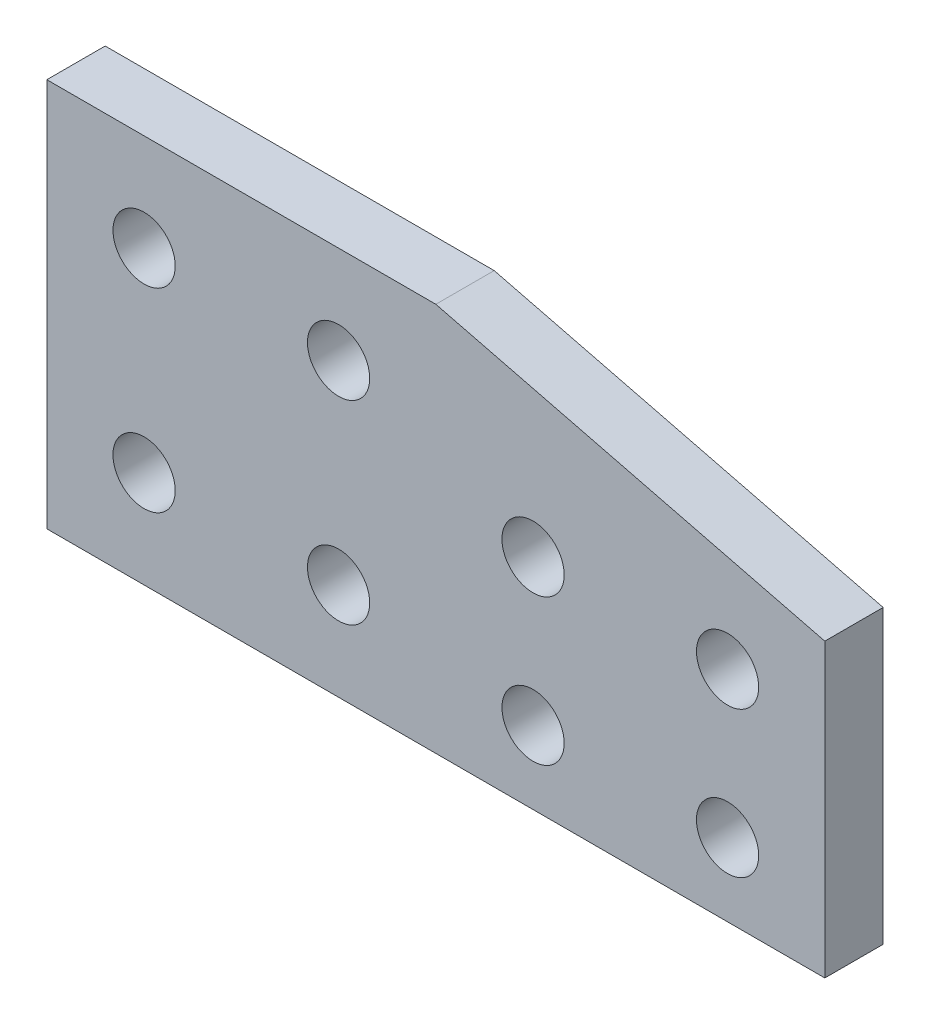
from build123d import *

# Parameters (mm, degrees)
EXTRUDE_1_DEPTH     = 3
SKETCH_2_R          = 1.6
CUT_EXTRUDE_1_DEPTH = 45.821869662
EXTRUDE_2_DEPTH     = 3


with BuildPart() as part:
    # 草图1 → 凸台-拉伸1 (new body)
    with BuildSketch(Plane.XY):
        Polygon((0, 0), (20, 0), (20, -5), (40, -5), (40, -20), (0, -20), align=None)
    extrude(amount=EXTRUDE_1_DEPTH)

    # 草图2 → 切除-拉伸1 (cut, through all)
    with BuildSketch(Plane.XY.offset(3)):
        with Locations((5, -5)):
            Circle(SKETCH_2_R)
        with Locations((35, -8.75)):
            Circle(SKETCH_2_R)
        with Locations(Location((5, -15, 0), (0, 0, 180))):
            Circle(SKETCH_2_R)
        with Locations(Location((15, -5, 0), (0, 0, 180))):
            Circle(SKETCH_2_R)
        with Locations((15, -15)):
            Circle(SKETCH_2_R)
        with Locations(Location((35, -16.25, 0), (0, 0, 180))):
            Circle(SKETCH_2_R)
        with Locations((25, -16.25)):
            Circle(SKETCH_2_R)
        with Locations(Location((25, -8.75, 0), (0, 0, 180))):
            Circle(SKETCH_2_R)
    extrude(amount=-CUT_EXTRUDE_1_DEPTH, mode=Mode.SUBTRACT)

    # 草图4 → 凸台-拉伸2 (add)
    with BuildSketch(Plane.XY.offset(3)):
        Polygon((20, 0), (40, -5), (20, -5), align=None)
    extrude(amount=-EXTRUDE_2_DEPTH)


solid = part.part
